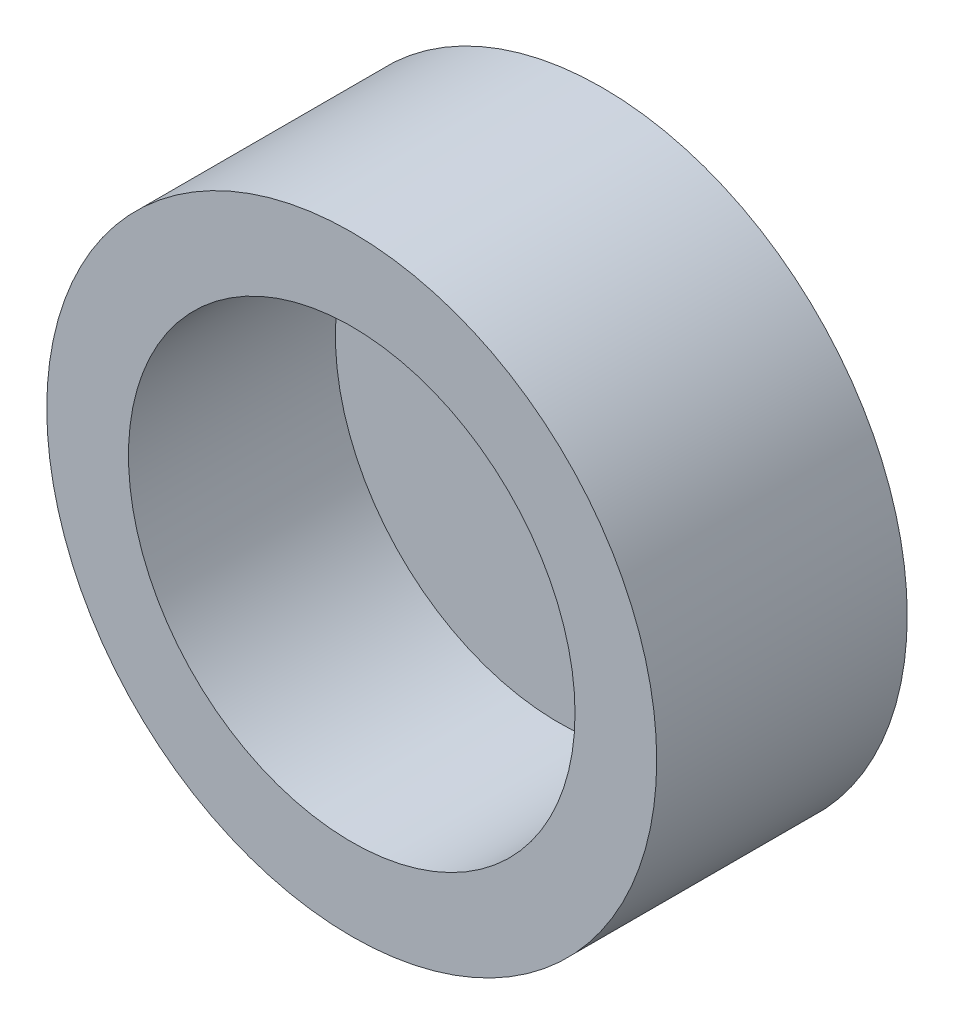
from build123d import *

# Parameters (mm, degrees)
CROQUIS1_R              = 56
SALIENTE_EXTRUIR1_DEPTH = 23
CROQUIS2_R              = 41
CORTAR_EXTRUIR1_DEPTH   = 38


with BuildPart() as part:
    # Croquis1 → Saliente-Extruir1 (new, symmetric)
    with BuildSketch(Plane.XY):
        Circle(CROQUIS1_R)
    extrude(amount=SALIENTE_EXTRUIR1_DEPTH, both=True)

    # Croquis2 → Cortar-Extruir1 (cut)
    with BuildSketch(Plane.XY.offset(23)):
        Circle(CROQUIS2_R)
    extrude(amount=-CORTAR_EXTRUIR1_DEPTH, mode=Mode.SUBTRACT)


solid = part.part
